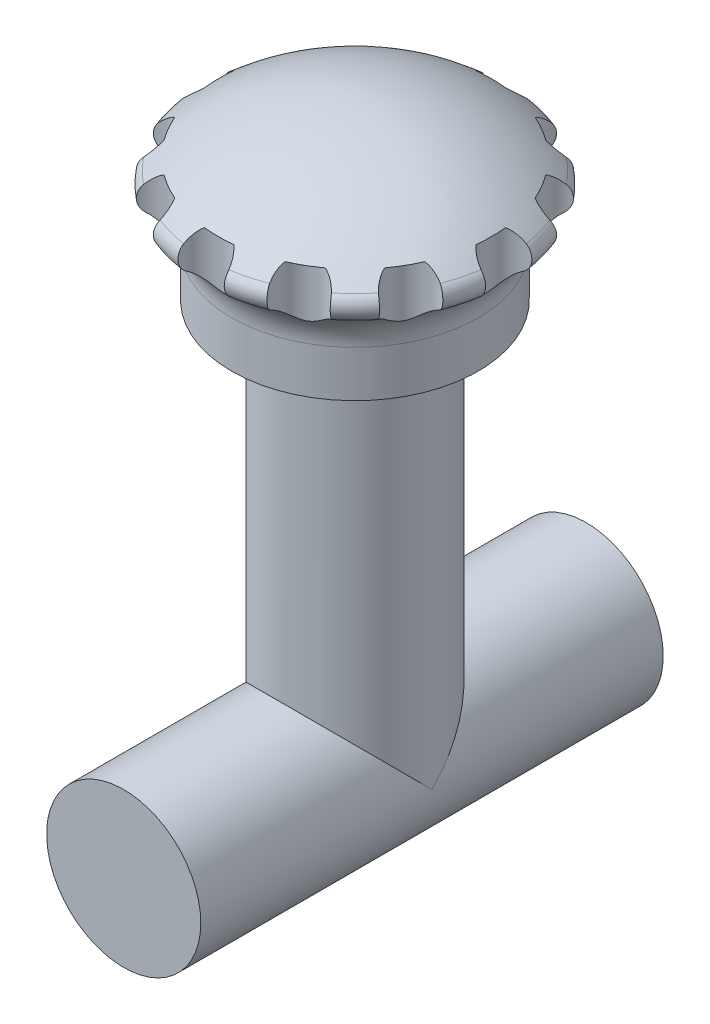
from build123d import *

# Parameters (mm, degrees)
SKETCH1_R           = 5
BOSS_EXTRUDE1_DEPTH = 30
SKETCH2_R           = 5
BOSS_EXTRUDE2_DEPTH = 25
SKETCH3_R           = 8
SKETCH3_R_2         = 5
BOSS_EXTRUDE3_DEPTH = 3
CUT_EXTRUDE3_DEPTH  = 5
CIRPATTERN1_COUNT   = 12


with BuildPart() as part:
    # Sketch1 → Boss-Extrude1 (new body)
    with BuildSketch(Plane.XY):
        Circle(SKETCH1_R)
    extrude(amount=-BOSS_EXTRUDE1_DEPTH)

    # Sketch2 → Boss-Extrude2 (add)
    with BuildSketch(Plane(origin=(0, 0, 0), x_dir=(1, 0, 0), z_dir=(0, 1, 0))):
        with Locations((0, 15)):
            Circle(SKETCH2_R)
    extrude(amount=BOSS_EXTRUDE2_DEPTH)

    # Sketch3 → Boss-Extrude3 (add)
    # profile 1 of 2: a face of its own
    with BuildSketch(Plane(origin=(0, 25, 0), x_dir=(1, 0, 0), z_dir=(0, 1, 0))):
        with Locations(Location((0, 15, 0), (0, 0, 270))):
            Circle(SKETCH3_R)
        with Locations((0, 15)):
            Circle(SKETCH3_R_2, mode=Mode.SUBTRACT)
    # profile 2 of 2: a face of its own
    with BuildSketch(Plane(origin=(0, 25, 0), x_dir=(1, 0, 0), z_dir=(0, 1, 0))):
        with Locations((0, 15)):
            Circle(SKETCH3_R_2)
    extrude(amount=BOSS_EXTRUDE3_DEPTH)

    # Sketch5 → Revolve1 (revolve)
    with BuildSketch(Plane(origin=(0, 0, 0), x_dir=(0, 0, -1), z_dir=(1, 0, 0)), mode=Mode.PRIVATE) as revolve1_sk:
        with BuildLine():
            Line((15, 28), (23, 28))
            ThreePointArc((23, 28), (23.421694205, 29.533733753), (24.56822615, 30.636289749))
            ThreePointArc((24.56822615, 30.636289749), (25.084096681, 31.398023857), (24.759421745, 32.258806896))
            ThreePointArc((24.759421745, 32.258806896), (20.22596495, 35.032655293), (15, 36))
            Line((15, 36), (15, 28))
        make_face()
    revolve(revolve1_sk.sketch.rotate(Axis((0, 36, -15), (0, -1, 0)), 180), axis=Axis((0, 36, -15), (0, -1, 0)))

    # Sketch6 → Cut-Extrude3 (cut, symmetric)
    with BuildSketch(Plane(origin=(0, 28, 0), x_dir=(1, 0, 0), z_dir=(0, 1, 0))):
        with BuildLine():
            ThreePointArc((-9.391937254, 18.690413776), (-7.335646662, 19.235237575), (-7.891960707, 21.288449365))
            ThreePointArc((-7.891960707, 21.288449365), (-8.73903481, 20.0454841), (-9.391937254, 18.690413776))
        make_face()
    cut_extrude3 = extrude(amount=CUT_EXTRUDE3_DEPTH, both=True, mode=Mode.SUBTRACT)

    # CirPattern1: Cut-Extrude3 ×12 about axis
    cirpattern1_axis = Axis((0, 0, -15), (0, 1, 0))
    for i in range(1, CIRPATTERN1_COUNT):
        add(cut_extrude3.rotate(cirpattern1_axis, i * 360 / CIRPATTERN1_COUNT), mode=Mode.SUBTRACT)


solid = part.part
